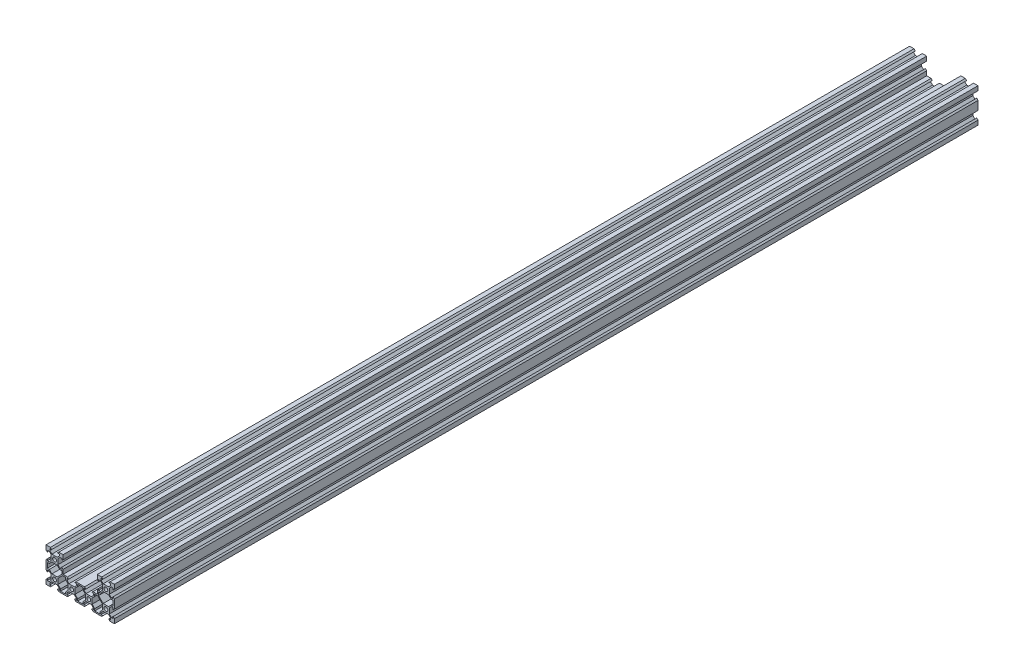
from build123d import *

# Parameters (mm, degrees)
SKETCH2_R           = 2.25
BOSS_EXTRUDE1_DEPTH = 1010


with BuildPart() as part:
    # Sketch2 → Boss-Extrude1 (new body)
    with BuildSketch(Plane.XY):
        Polygon((-5.125, -10), (5.125, -10), (6.625, -8.5), (4.5, -8.5), (4.5, -6.383883476), (6.883883476, -4), (13.116116524, -4), (15.5, -6.383883476), (15.5, -8.5), (13.375, -8.5), (14.875, -10), (25.125, -10), (26.625, -8.5), (24.5, -8.5), (24.5, -6.383883476), (26.883883476, -4), (33.116116524, -4), (35.5, -6.383883476), (35.5, -8.5), (33.375, -8.5), (34.875, -10), (40, -10), (40, -4.875), (38.5, -3.375), (38.5, -5.5), (36.383883476, -5.5), (34, -3.116116524), (34, 3.116116524), (36.383883476, 5.5), (38.5, 5.5), (38.5, 3.375), (40, 4.875), (40, 15.125), (38.5, 16.625), (38.5, 14.5), (36.383883476, 14.5), (34, 16.883883476), (34, 23.116116524), (36.383883476, 25.5), (38.5, 25.5), (38.5, 23.375), (40, 24.875), (40, 30), (34.875, 30), (33.375, 28.5), (35.5, 28.5), (35.5, 26.383883476), (33.116116524, 24), (26.883883476, 24), (24.5, 26.383883476), (24.5, 28.5), (26.625, 28.5), (25.125, 30), (20, 30), (20, 24.875), (21.5, 23.375), (21.5, 25.5), (23.616116524, 25.5), (26, 23.116116524), (26, 16.883883476), (23.616116524, 14.5), (21.5, 14.5), (21.5, 16.625), (20, 15.125), (20, 10), (14.875, 10), (13.375, 8.5), (15.5, 8.5), (15.5, 6.383883476), (13.116116524, 4), (6.883883476, 4), (4.5, 6.383883476), (4.5, 8.5), (6.625, 8.5), (5.125, 10), (-5.125, 10), (-6.625, 8.5), (-4.5, 8.5), (-4.5, 6.383883476), (-6.883883476, 4), (-13.116116524, 4), (-15.5, 6.383883476), (-15.5, 8.5), (-13.375, 8.5), (-14.875, 10), (-20, 10), (-20, 15.125), (-21.5, 16.625), (-21.5, 14.5), (-23.616116524, 14.5), (-26, 16.883883476), (-26, 23.116116524), (-23.616116524, 25.5), (-21.5, 25.5), (-21.5, 23.375), (-20, 24.875), (-20, 30), (-25.125, 30), (-26.625, 28.5), (-24.5, 28.5), (-24.5, 26.383883476), (-26.883883476, 24), (-33.116116524, 24), (-35.5, 26.383883476), (-35.5, 28.5), (-33.375, 28.5), (-34.875, 30), (-40, 30), (-40, 24.875), (-38.5, 23.375), (-38.5, 25.5), (-36.383883476, 25.5), (-34, 23.116116524), (-34, 16.883883476), (-36.383883476, 14.5), (-38.5, 14.5), (-38.5, 16.625), (-40, 15.125), (-40, 4.875), (-38.5, 3.375), (-38.5, 5.5), (-36.383883476, 5.5), (-34, 3.116116524), (-34, -3.116116524), (-36.383883476, -5.5), (-38.5, -5.5), (-38.5, -3.375), (-40, -4.875), (-40, -10), (-34.875, -10), (-33.375, -8.5), (-35.5, -8.5), (-35.5, -6.383883476), (-33.116116524, -4), (-26.883883476, -4), (-24.5, -6.383883476), (-24.5, -8.5), (-26.625, -8.5), (-25.125, -10), (-14.875, -10), (-13.375, -8.5), (-15.5, -8.5), (-15.5, -6.383883476), (-13.116116524, -4), (-6.883883476, -4), (-4.5, -6.383883476), (-4.5, -8.5), (-6.625, -8.5), align=None)
        with Locations((-30, 0)):
            Circle(SKETCH2_R, mode=Mode.SUBTRACT)
        Polygon((-26, -3.116116524), (-26, 3.109045456), (-20.609045456, 8.5), (-17, 8.5), (-17, 6.116116524), (-14, 3.116116524), (-14, -3.116116524), (-17, -6.116116524), (-17, -8.5), (-23, -8.5), (-23, -6.116116524), align=None, mode=Mode.SUBTRACT)
        with Locations((-10, 0)):
            Circle(SKETCH2_R, mode=Mode.SUBTRACT)
        Polygon((-6, -3.116116524), (-6, 3.116116524), (-3, 6.116116524), (-3, 8.5), (3, 8.5), (3, 6.116116524), (6, 3.116116524), (6, -3.116116524), (3, -6.116116524), (3, -8.5), (-3, -8.5), (-3, -6.116116524), align=None, mode=Mode.SUBTRACT)
        with Locations((10, 0)):
            Circle(SKETCH2_R, mode=Mode.SUBTRACT)
        Polygon((26, 3.109045456), (26, -3.116116524), (23, -6.116116524), (23, -8.5), (17, -8.5), (17, -6.116116524), (14, -3.116116524), (14, 3.116116524), (17, 6.116116524), (17, 8.5), (20.609045456, 8.5), align=None, mode=Mode.SUBTRACT)
        with Locations((30, 0)):
            Circle(SKETCH2_R, mode=Mode.SUBTRACT)
        Polygon((-36.116116524, 13), (-33.116116524, 16), (-26.883883476, 16), (-23.883883476, 13), (-21.5, 13), (-21.5, 9.390954544), (-26.890954544, 4), (-33.116116524, 4), (-36.116116524, 7), (-38.5, 7), (-38.5, 13), align=None, mode=Mode.SUBTRACT)
        with Locations((-30, 20)):
            Circle(SKETCH2_R, mode=Mode.SUBTRACT)
        Polygon((33.116116524, 16), (36.116116524, 13), (38.5, 13), (38.5, 7), (36.116116524, 7), (33.116116524, 4), (26.890954544, 4), (21.5, 9.390954544), (21.5, 13), (23.883883476, 13), (26.883883476, 16), align=None, mode=Mode.SUBTRACT)
        with Locations((30, 20)):
            Circle(SKETCH2_R, mode=Mode.SUBTRACT)
    extrude(amount=BOSS_EXTRUDE1_DEPTH)


solid = part.part
